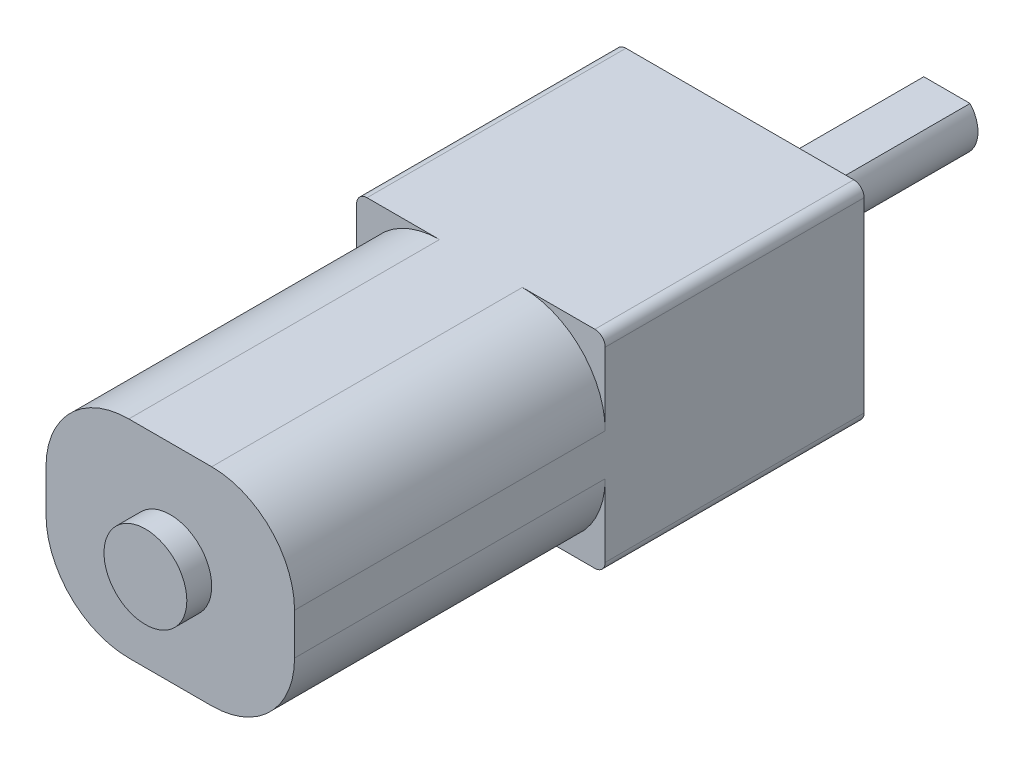
from build123d import *

# Parameters (mm, degrees)
SKETCH1_W           = 12
SKETCH1_H           = 10
BOSS_EXTRUDE1_DEPTH = 15
FILLET1_R           = 4
SKETCH3_W           = 12
SKETCH3_H           = 10
BOSS_EXTRUDE2_DEPTH = 12.5
SKETCH4_R           = 2
BOSS_EXTRUDE3_DEPTH = 0.7
BOSS_EXTRUDE4_DEPTH = 9.3
SKETCH7_R           = 0.8
CUT_EXTRUDE1_DEPTH  = 2
BOSS_EXTRUDE5_START = 1.2
SKETCH8_R           = 2
BOSS_EXTRUDE5_DEPTH = 1.2
FILLET2_R           = 0.5


with BuildPart() as part:
    # Sketch1 → Boss-Extrude1 (new body)
    with BuildSketch(Plane.XY):
        with Locations((6, 5)):
            Rectangle(SKETCH1_W, SKETCH1_H)
    extrude(amount=BOSS_EXTRUDE1_DEPTH)

    # Fillet1
    fillet1_edges = [part.edges().sort_by_distance(p)[0] for p in [
        (0, 10, 7.5),
        (12, 10, 7.5),
        (12, 0, 7.5),
        (0, 0, 7.5),
    ]]
    fillet(fillet1_edges, radius=FILLET1_R)

    # Sketch3 → Boss-Extrude2 (add)
    with BuildSketch(Plane.XY):
        with Locations((6, 5)):
            Rectangle(SKETCH3_W, SKETCH3_H)
    extrude(amount=-BOSS_EXTRUDE2_DEPTH)

    # Sketch4 → Boss-Extrude3 (add)
    with BuildSketch(Plane(origin=(0, 0, -12.5), x_dir=(-1, 0, 0), z_dir=(0, 0, -1))):
        with Locations((-6, 5)):
            Circle(SKETCH4_R)
    extrude(amount=BOSS_EXTRUDE3_DEPTH)

    # Sketch5 → Boss-Extrude4 (add)
    with BuildSketch(Plane(origin=(0, 0, -13.2), x_dir=(-1, 0, 0), z_dir=(0, 0, -1))):
        with BuildLine():
            Line((-7.118033989, 6), (-4.881966011, 6))
            ThreePointArc((-4.881966011, 6), (-6, 3.5), (-7.118033989, 6))
        make_face()
    extrude(amount=BOSS_EXTRUDE4_DEPTH)

    # Sketch7 → Cut-Extrude1 (cut)
    with BuildSketch(Plane(origin=(0, 0, -12.5), x_dir=(-1, 0, 0), z_dir=(0, 0, -1))):
        with Locations((-10.5, 5)):
            Circle(SKETCH7_R)
        with Locations((-1.5, 5)):
            Circle(SKETCH7_R)
    extrude(amount=-CUT_EXTRUDE1_DEPTH, mode=Mode.SUBTRACT)

    # Sketch8 → Boss-Extrude5 (add)
    with BuildSketch(Plane.XY.offset(15).offset(BOSS_EXTRUDE5_START)):
        with Locations(Location((6, 5, 0), (0, 0, 180))):
            Circle(SKETCH8_R)
    extrude(amount=-BOSS_EXTRUDE5_DEPTH)

    # Fillet2
    fillet2_edges = [part.edges().sort_by_distance(p)[0] for p in [
        (0, 0, -6.25),
        (0, 10, -6.25),
        (12, 10, -6.25),
        (12, 0, -6.25),
    ]]
    fillet(fillet2_edges, radius=FILLET2_R)


solid = part.part
